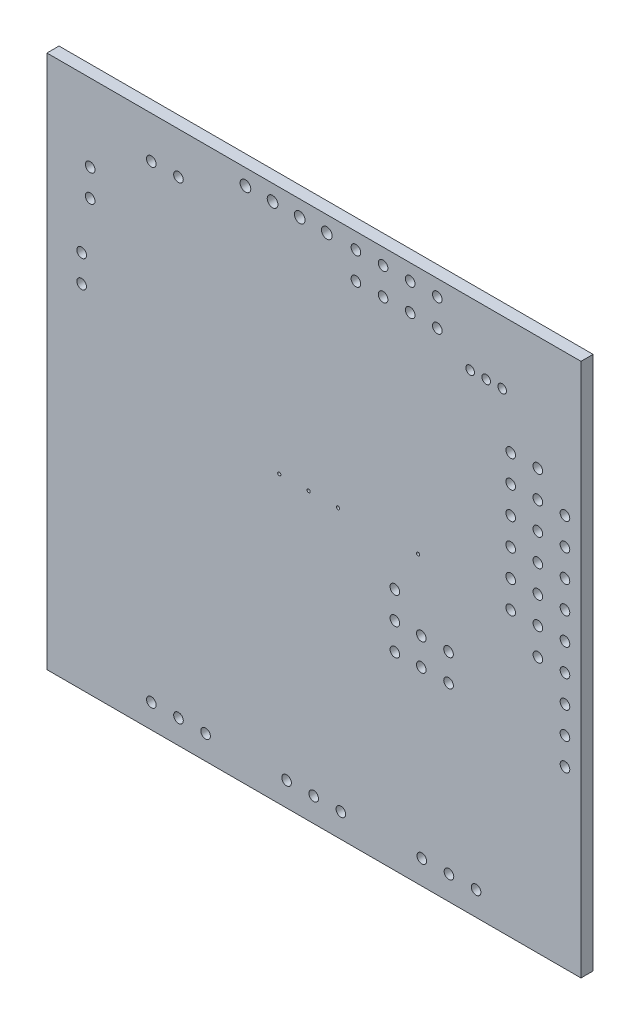
from build123d import *

# Parameters (mm, degrees)
SKETCH_1_W      = 49.99999906
SKETCH_1_H      = 49.99999906
SKETCH_1_R      = 0.4499991
SKETCH_1_R_2    = 0.3999992
SKETCH_1_R_3    = 0.499999
SKETCH_1_R_4    = 0.1499997
EXTRUDE_1_DEPTH = 1.13284


with BuildPart() as part:
    # Эскиз1 → Бобышка-Вытянуть1 (new body)
    with BuildSketch(Plane.XY.offset(1.13284)):
        with Locations((34.25000135, 36.75000143)):
            Rectangle(SKETCH_1_W, SKETCH_1_H)
        with Locations(Location((57.75002166, 48.50003254, 0), (0, 0, 180))):
            Circle(SKETCH_1_R, mode=Mode.SUBTRACT)
        with Locations(Location((57.75002166, 45.95002494, 0), (0, 0, 180))):
            Circle(SKETCH_1_R, mode=Mode.SUBTRACT)
        with Locations(Location((55.21002166, 51.05004014, 0), (0, 0, 180))):
            Circle(SKETCH_1_R, mode=Mode.SUBTRACT)
        with Locations(Location((55.21002166, 48.50003254, 0), (0, 0, 180))):
            Circle(SKETCH_1_R, mode=Mode.SUBTRACT)
        with Locations(Location((55.21002166, 45.95002494, 0), (0, 0, 180))):
            Circle(SKETCH_1_R, mode=Mode.SUBTRACT)
        with Locations(Location((57.75002166, 43.40001734, 0), (0, 0, 180))):
            Circle(SKETCH_1_R, mode=Mode.SUBTRACT)
        with Locations(Location((52.67002166, 43.40001734, 0), (0, 0, 180))):
            Circle(SKETCH_1_R, mode=Mode.SUBTRACT)
        with Locations(Location((55.21002166, 43.40001734, 0), (0, 0, 180))):
            Circle(SKETCH_1_R, mode=Mode.SUBTRACT)
        with Locations(Location((50.37499958, 55.85000006, 0), (0, 0, 180))):
            Circle(SKETCH_1_R_2, mode=Mode.SUBTRACT)
        with Locations(Location((51.87499912, 55.85000006, 0), (0, 0, 180))):
            Circle(SKETCH_1_R_2, mode=Mode.SUBTRACT)
        with Locations(Location((45.79999984, 60.24999888, 0), (0, 0, 180))):
            Circle(SKETCH_1_R, mode=Mode.SUBTRACT)
        with Locations(Location((45.79999984, 57.70999888, 0), (0, 0, 180))):
            Circle(SKETCH_1_R, mode=Mode.SUBTRACT)
        with Locations(Location((52.67002166, 48.50003254, 0), (0, 0, 180))):
            Circle(SKETCH_1_R, mode=Mode.SUBTRACT)
        with Locations(Location((52.67002166, 45.95002494, 0), (0, 0, 180))):
            Circle(SKETCH_1_R, mode=Mode.SUBTRACT)
        with Locations(Location((48.87500004, 55.85000006, 0), (0, 0, 180))):
            Circle(SKETCH_1_R_2, mode=Mode.SUBTRACT)
        with Locations(Location((52.67002166, 51.05004014, 0), (0, 0, 180))):
            Circle(SKETCH_1_R, mode=Mode.SUBTRACT)
        with Locations(Location((57.75002166, 40.85000974, 0), (0, 0, 180))):
            Circle(SKETCH_1_R, mode=Mode.SUBTRACT)
        with Locations(Location((57.75002166, 38.30000214, 0), (0, 0, 180))):
            Circle(SKETCH_1_R, mode=Mode.SUBTRACT)
        with Locations(Location((55.21002166, 40.85000974, 0), (0, 0, 180))):
            Circle(SKETCH_1_R, mode=Mode.SUBTRACT)
        with Locations(Location((55.21002166, 38.30000214, 0), (0, 0, 180))):
            Circle(SKETCH_1_R, mode=Mode.SUBTRACT)
        with Locations(Location((57.75002166, 35.74999454, 0), (0, 0, 180))):
            Circle(SKETCH_1_R, mode=Mode.SUBTRACT)
        with Locations(Location((57.7499988, 33.20000218, 0), (0, 0, 180))):
            Circle(SKETCH_1_R, mode=Mode.SUBTRACT)
        with Locations(Location((57.7499988, 30.66000218, 0), (0, 0, 180))):
            Circle(SKETCH_1_R, mode=Mode.SUBTRACT)
        with Locations(Location((57.7499988, 28.12000218, 0), (0, 0, 180))):
            Circle(SKETCH_1_R, mode=Mode.SUBTRACT)
        with Locations(Location((52.67002166, 40.85000974, 0), (0, 0, 180))):
            Circle(SKETCH_1_R, mode=Mode.SUBTRACT)
        with Locations(Location((55.21002166, 35.74999454, 0), (0, 0, 180))):
            Circle(SKETCH_1_R, mode=Mode.SUBTRACT)
        with Locations(Location((52.67002166, 38.30000214, 0), (0, 0, 180))):
            Circle(SKETCH_1_R, mode=Mode.SUBTRACT)
        with Locations(Location((46.85012474, 32.00998424, 0), (0, 0, 180))):
            Circle(SKETCH_1_R, mode=Mode.SUBTRACT)
        with Locations(Location((46.89004846, 14.00002534, 0), (0, 0, 180))):
            Circle(SKETCH_1_R, mode=Mode.SUBTRACT)
        with Locations(Location((49.43004846, 14.00002534, 0), (0, 0, 180))):
            Circle(SKETCH_1_R, mode=Mode.SUBTRACT)
        with Locations(Location((46.85012474, 29.46998424, 0), (0, 0, 180))):
            Circle(SKETCH_1_R, mode=Mode.SUBTRACT)
        with Locations(Location((44.35004846, 14.00002534, 0), (0, 0, 180))):
            Circle(SKETCH_1_R, mode=Mode.SUBTRACT)
        with Locations(Location((40.71999984, 60.24999888, 0), (0, 0, 180))):
            Circle(SKETCH_1_R, mode=Mode.SUBTRACT)
        with Locations(Location((43.25999984, 60.24999888, 0), (0, 0, 180))):
            Circle(SKETCH_1_R, mode=Mode.SUBTRACT)
        with Locations(Location((32.91498116, 60.26500012, 0), (0, 0, 180))):
            Circle(SKETCH_1_R_3, mode=Mode.SUBTRACT)
        with Locations(Location((35.45498116, 60.26500012, 0), (0, 0, 180))):
            Circle(SKETCH_1_R_3, mode=Mode.SUBTRACT)
        with Locations(Location((40.71999984, 57.70999888, 0), (0, 0, 180))):
            Circle(SKETCH_1_R, mode=Mode.SUBTRACT)
        with Locations(Location((43.25999984, 57.70999888, 0), (0, 0, 180))):
            Circle(SKETCH_1_R, mode=Mode.SUBTRACT)
        with Locations(Location((38.17999984, 60.24999888, 0), (0, 0, 180))):
            Circle(SKETCH_1_R, mode=Mode.SUBTRACT)
        with Locations(Location((38.17999984, 57.70999888, 0), (0, 0, 180))):
            Circle(SKETCH_1_R, mode=Mode.SUBTRACT)
        with Locations(Location((27.83498116, 60.26500012, 0), (0, 0, 180))):
            Circle(SKETCH_1_R_3, mode=Mode.SUBTRACT)
        with Locations(Location((30.37498116, 60.26500012, 0), (0, 0, 180))):
            Circle(SKETCH_1_R_3, mode=Mode.SUBTRACT)
        with Locations(Location((19.02499878, 57.85000114, 0), (0, 0, 180))):
            Circle(SKETCH_1_R, mode=Mode.SUBTRACT)
        with Locations(Location((21.56499878, 57.85000114, 0), (0, 0, 180))):
            Circle(SKETCH_1_R, mode=Mode.SUBTRACT)
        with Locations(Location((13.2999988, 54.5249989, 0), (0, 0, 180))):
            Circle(SKETCH_1_R, mode=Mode.SUBTRACT)
        with Locations(Location((13.2999988, 51.9849989, 0), (0, 0, 180))):
            Circle(SKETCH_1_R, mode=Mode.SUBTRACT)
        with Locations(Location((12.50000548, 47.1899996, 0), (0, 0, 180))):
            Circle(SKETCH_1_R, mode=Mode.SUBTRACT)
        with Locations(Location((12.50000548, 44.6499996, 0), (0, 0, 180))):
            Circle(SKETCH_1_R, mode=Mode.SUBTRACT)
        with Locations(Location((43.99998566, 38.50000174, 0), (0, 0, 180))):
            Circle(SKETCH_1_R_4, mode=Mode.SUBTRACT)
        with Locations(Location((41.82503446, 34.54998424, 0), (0, 0, 180))):
            Circle(SKETCH_1_R, mode=Mode.SUBTRACT)
        with Locations(Location((36.50002606, 38.50000174, 0), (0, 0, 180))):
            Circle(SKETCH_1_R_4, mode=Mode.SUBTRACT)
        with Locations(Location((41.82503446, 32.00998424, 0), (0, 0, 180))):
            Circle(SKETCH_1_R, mode=Mode.SUBTRACT)
        with Locations(Location((44.3000892, 32.00998424, 0), (0, 0, 180))):
            Circle(SKETCH_1_R, mode=Mode.SUBTRACT)
        with Locations(Location((44.3000892, 29.46998424, 0), (0, 0, 180))):
            Circle(SKETCH_1_R, mode=Mode.SUBTRACT)
        with Locations(Location((41.82503446, 29.46998424, 0), (0, 0, 180))):
            Circle(SKETCH_1_R, mode=Mode.SUBTRACT)
        with Locations(Location((36.76753886, 14.00002534, 0), (0, 0, 180))):
            Circle(SKETCH_1_R, mode=Mode.SUBTRACT)
        with Locations(Location((33.75001886, 38.50000174, 0), (0, 0, 180))):
            Circle(SKETCH_1_R_4, mode=Mode.SUBTRACT)
        with Locations(Location((34.22753886, 14.00002534, 0), (0, 0, 180))):
            Circle(SKETCH_1_R, mode=Mode.SUBTRACT)
        with Locations(Location((31.00001166, 38.50000174, 0), (0, 0, 180))):
            Circle(SKETCH_1_R_4, mode=Mode.SUBTRACT)
        with Locations(Location((19.02502926, 14.00002534, 0), (0, 0, 180))):
            Circle(SKETCH_1_R, mode=Mode.SUBTRACT)
        with Locations(Location((24.10502926, 14.00002534, 0), (0, 0, 180))):
            Circle(SKETCH_1_R, mode=Mode.SUBTRACT)
        with Locations(Location((31.68753886, 14.00002534, 0), (0, 0, 180))):
            Circle(SKETCH_1_R, mode=Mode.SUBTRACT)
        with Locations(Location((21.56502926, 14.00002534, 0), (0, 0, 180))):
            Circle(SKETCH_1_R, mode=Mode.SUBTRACT)
    extrude(amount=-EXTRUDE_1_DEPTH)


solid = part.part
